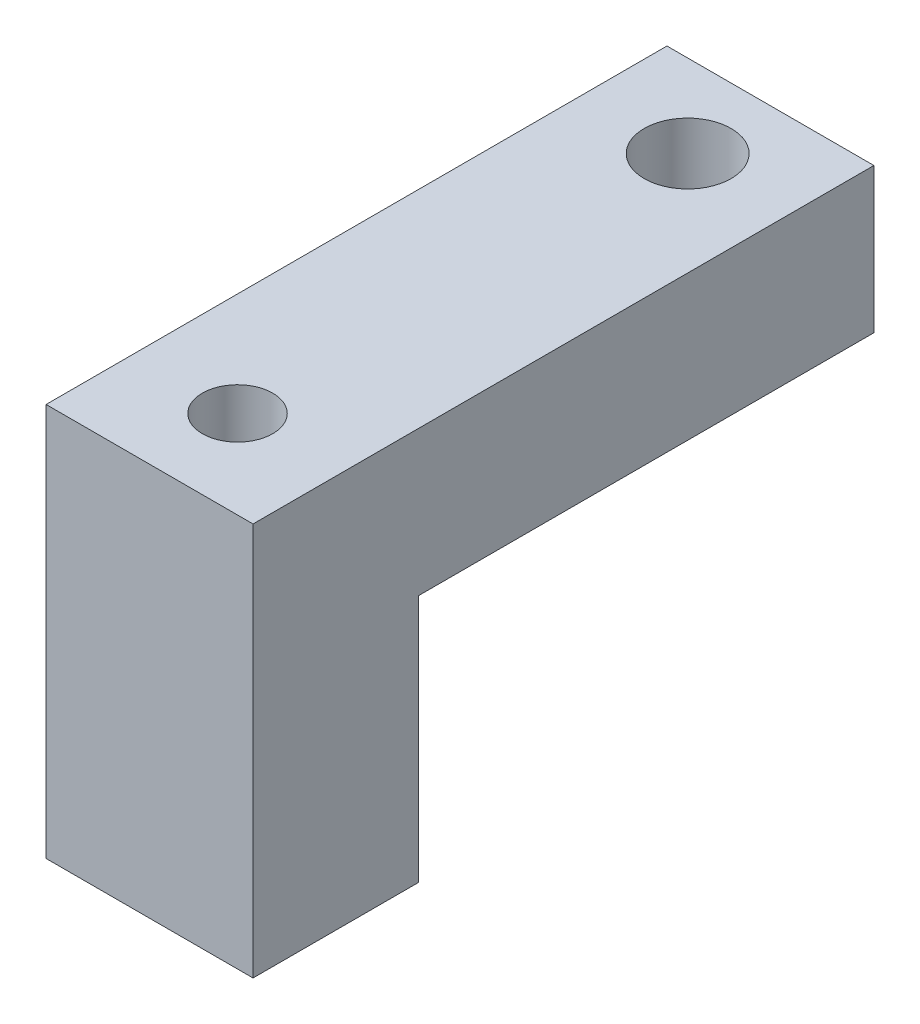
from build123d import *

# Parameters (mm, degrees)
SKETCH1_W           = 10
SKETCH1_H           = 30
SKETCH1_R           = 2.1
BOSS_EXTRUDE1_DEPTH = 7
SKETCH2_W           = 10
SKETCH2_H           = 8
BOSS_EXTRUDE2_DEPTH = 12
SKETCH3_R           = 1.7
CUT_EXTRUDE1_DEPTH  = 37.891733491


with BuildPart() as part:
    # Sketch1 → Boss-Extrude1 (new body)
    with BuildSketch(Plane(origin=(0, 0, 0), x_dir=(1, 0, 0), z_dir=(0, 1, 0))):
        with Locations((5, 15)):
            Rectangle(SKETCH1_W, SKETCH1_H)
        with Locations(Location((5, 26, 0), (0, 0, 270))):
            Circle(SKETCH1_R, mode=Mode.SUBTRACT)
    extrude(amount=BOSS_EXTRUDE1_DEPTH)

    # Sketch2 → Boss-Extrude2 (add)
    with BuildSketch(Plane(origin=(0, 0, 0), x_dir=(-1, 0, 0), z_dir=(0, -1, 0))):
        with Locations((-5, 4)):
            Rectangle(SKETCH2_W, SKETCH2_H)
    extrude(amount=BOSS_EXTRUDE2_DEPTH)

    # Sketch3 → Cut-Extrude1 (cut, through all)
    with BuildSketch(Plane(origin=(0, 7, 0), x_dir=(1, 0, 0), z_dir=(0, 1, 0))):
        with Locations(Location((5, 4.25, 0), (0, 0, 270))):
            Circle(SKETCH3_R)
    extrude(amount=-CUT_EXTRUDE1_DEPTH, mode=Mode.SUBTRACT)


solid = part.part
